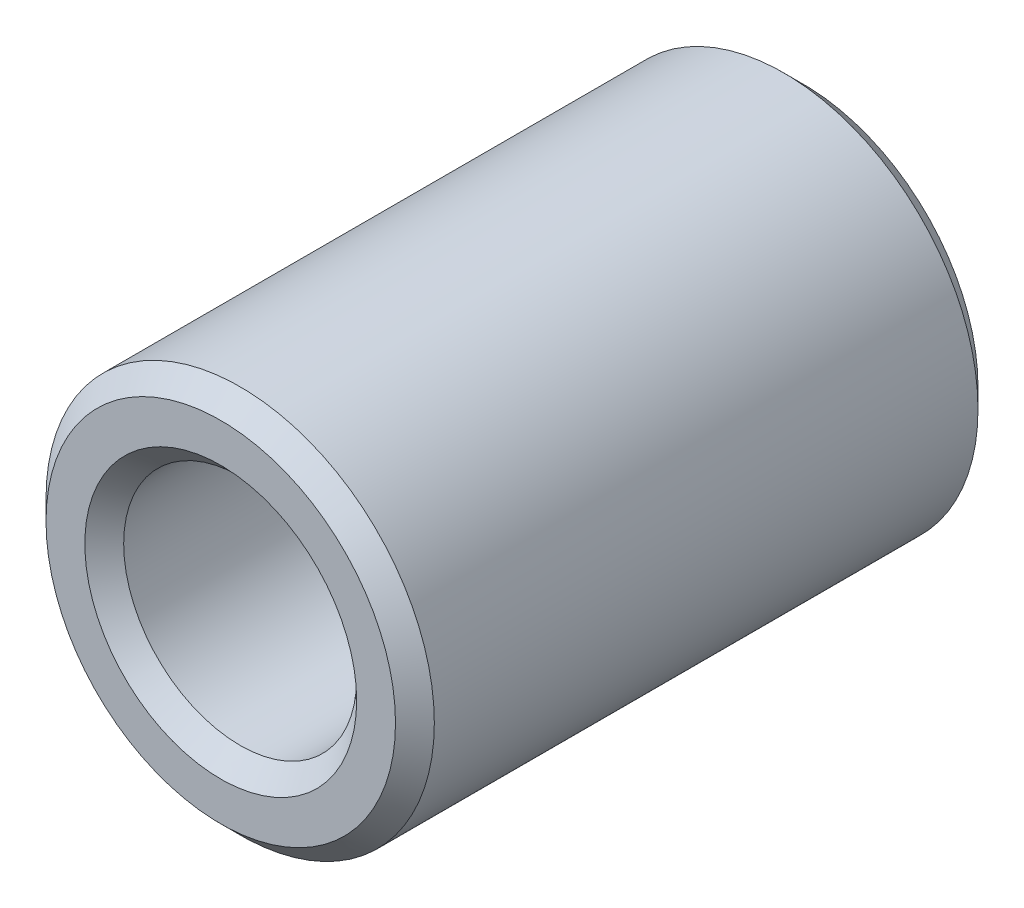
from build123d import *

# Parameters (mm, degrees)
SKETCH_1_R      = 5
SKETCH_1_R_2    = 3
EXTRUDE_1_DEPTH = 15
CHAMFER_1_SIZE  = 0.5


with BuildPart() as part:
    # Эскиз1 → Бобышка-Вытянуть1 (new body)
    with BuildSketch(Plane.XY):
        Circle(SKETCH_1_R)
        Circle(SKETCH_1_R_2, mode=Mode.SUBTRACT)
    extrude(amount=EXTRUDE_1_DEPTH)

    # Фаска1
    chamfer_1_edges = [part.edges().sort_by_distance(p)[0] for p in [
        (-5, 0, 0),
        (-5, 0, 15),
        (-3, 0, 0),
        (-3, 0, 15),
    ]]
    chamfer(chamfer_1_edges, length=CHAMFER_1_SIZE)


solid = part.part
